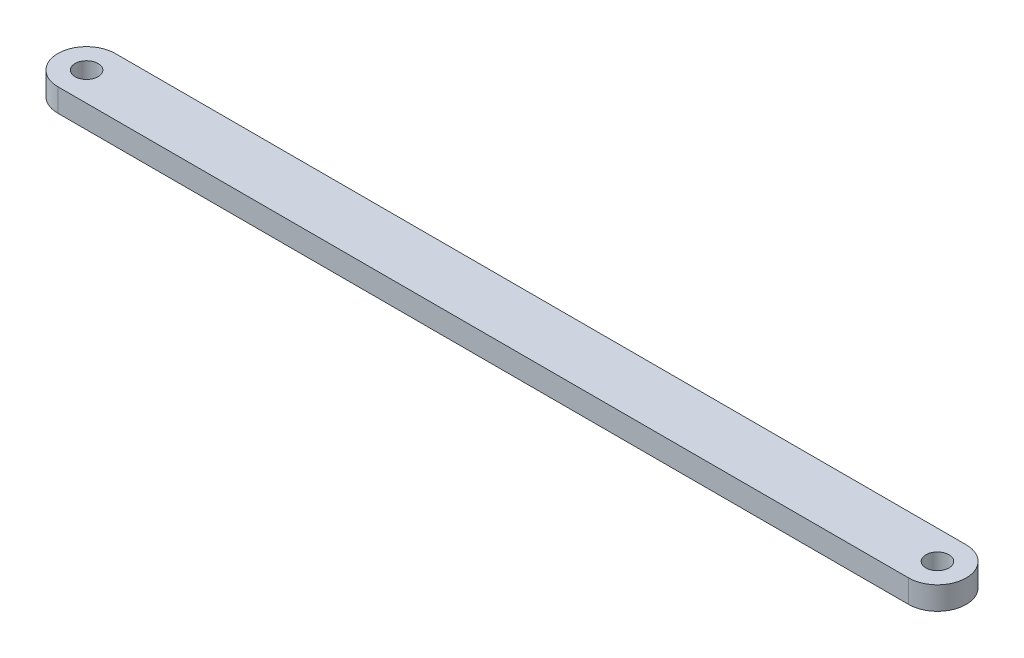
from build123d import *

# Parameters (mm, degrees)
SKETCH1_R           = 1
BOSS_EXTRUDE1_DEPTH = 2


with BuildPart() as part:
    # Sketch1 → Boss-Extrude1 (new body)
    with BuildSketch(Plane(origin=(0, 0, 0), x_dir=(1, 0, 0), z_dir=(0, 1, 0))):
        with BuildLine():
            Line((0, 0), (-74, 0))
            ThreePointArc((-74, 0), (-76.5, -2.5), (-74, -5))
            Line((-74, -5), (0, -5))
            ThreePointArc((0, -5), (2.5, -2.5), (0, 0))
        make_face()
        with Locations(Location((-74, -2.5, 0), (0, 0, 270))):
            Circle(SKETCH1_R, mode=Mode.SUBTRACT)
        with Locations(Location((0, -2.5, 0), (0, 0, 270))):
            Circle(SKETCH1_R, mode=Mode.SUBTRACT)
    extrude(amount=BOSS_EXTRUDE1_DEPTH)


solid = part.part
